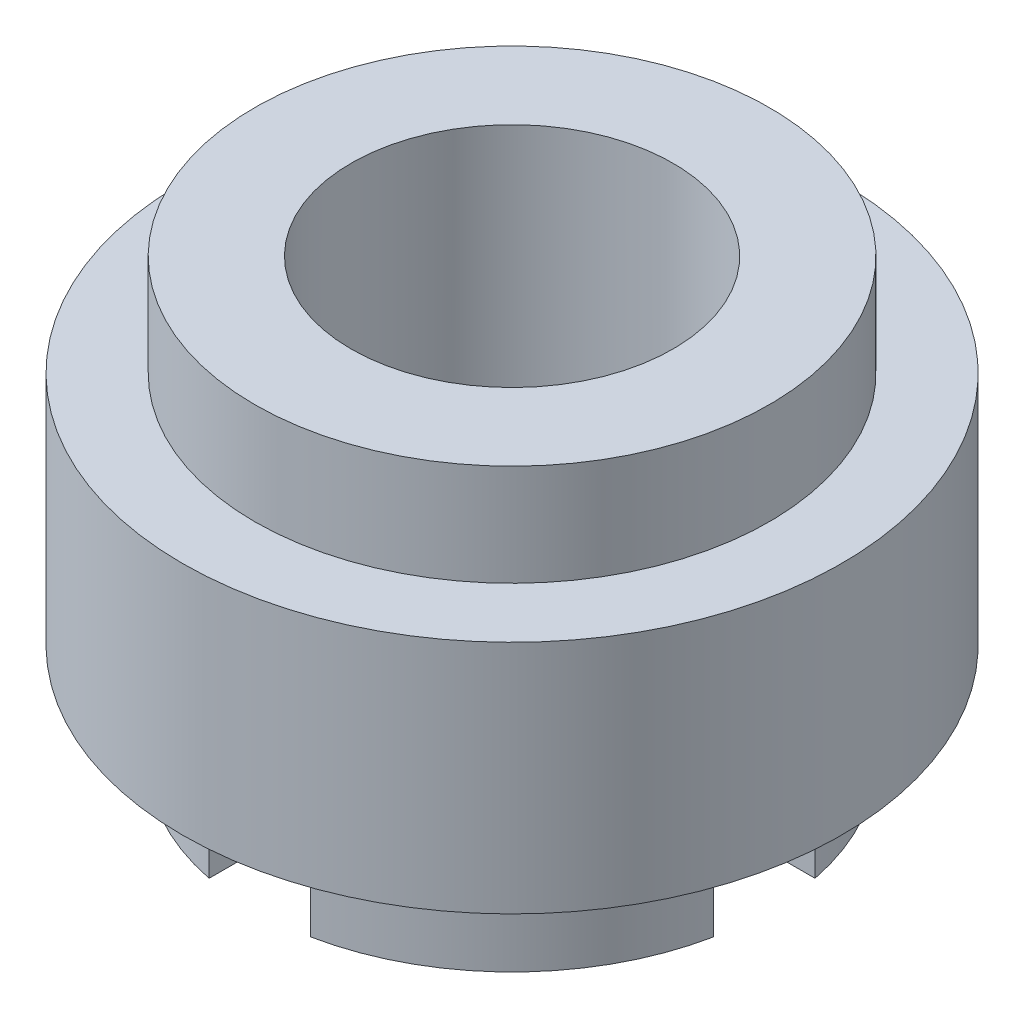
from build123d import *

# Parameters (mm, degrees)
SKETCH1_R               = 6.5
BOSS_EXTRUDE1_DEPTH     = 4.64
SKETCH2_R               = 5.075
BOSS_EXTRUDE2_DEPTH     = 2
BOSS_EXTRUDE3_START     = 2
SKETCH3_R               = 5.075
BOSS_EXTRUDE3_DEPTH     = 2
SKETCH4_R               = 3.175
CUT_EXTRUDE1_DEPTH      = 13.615450844
CUT_EXTRUDE2_DEPTH      = 12.339735447
CUT_EXTRUDE2_DEPTH_BACK = 12.339735447
CUT_EXTRUDE3_DEPTH      = 12.339735447
CUT_EXTRUDE3_DEPTH_BACK = 12.339735447
SKETCH6_W               = 1
SKETCH6_H               = 2


with BuildPart() as part:
    # Sketch1 → Boss-Extrude1 (new body)
    with BuildSketch(Plane(origin=(0, 0, 0), x_dir=(1, 0, 0), z_dir=(0, 1, 0))):
        with Locations(Location((0, 0, 0), (0, 0, 270))):
            Circle(SKETCH1_R)
    extrude(amount=BOSS_EXTRUDE1_DEPTH)

    # Sketch2 → Boss-Extrude2 (add)
    with BuildSketch(Plane(origin=(0, 4.64, 0), x_dir=(1, 0, 0), z_dir=(0, 1, 0))):
        with Locations(Location((0, 0, 0), (0, 0, 270))):
            Circle(SKETCH2_R)
    extrude(amount=BOSS_EXTRUDE2_DEPTH)

    # Sketch3 → Boss-Extrude3 (add)
    with BuildSketch(Plane.XZ.offset(BOSS_EXTRUDE3_START)):
        with Locations(Location((0, 0, 0), (0, 0, 90))):
            Circle(SKETCH3_R)
    extrude(amount=-BOSS_EXTRUDE3_DEPTH)

    # Sketch4 → Cut-Extrude1 (cut, through all)
    with BuildSketch(Plane(origin=(0, 6.64, 0), x_dir=(1, 0, 0), z_dir=(0, 1, 0))):
        with Locations(Location((0, 0, 0), (0, 0, 270))):
            Circle(SKETCH4_R)
    extrude(amount=-CUT_EXTRUDE1_DEPTH, mode=Mode.SUBTRACT)

    # Sketch5 → Cut-Extrude2 (cut, two sides: drawn at the far end of the back side and taken through both)
    with BuildSketch(Plane.XY.offset(-CUT_EXTRUDE2_DEPTH_BACK)):
        Polygon((0, 0), (-1, 0), (-1, -2), (1, -2), (1, 0), align=None)
    extrude(amount=CUT_EXTRUDE2_DEPTH + CUT_EXTRUDE2_DEPTH_BACK, mode=Mode.SUBTRACT)

    # Sketch6 → Cut-Extrude3 (cut, two sides: drawn at the far end of the back side and taken through both)
    with BuildSketch(Plane(origin=(0, 0, 0), x_dir=(0, 0, -1), z_dir=(1, 0, 0)).offset(-CUT_EXTRUDE3_DEPTH_BACK)):
        with Locations((0.5, -1)):
            Rectangle(SKETCH6_W, SKETCH6_H)
        with Locations((-0.5, -1)):
            Rectangle(SKETCH6_W, SKETCH6_H)
    extrude(amount=CUT_EXTRUDE3_DEPTH + CUT_EXTRUDE3_DEPTH_BACK, mode=Mode.SUBTRACT)


solid = part.part
